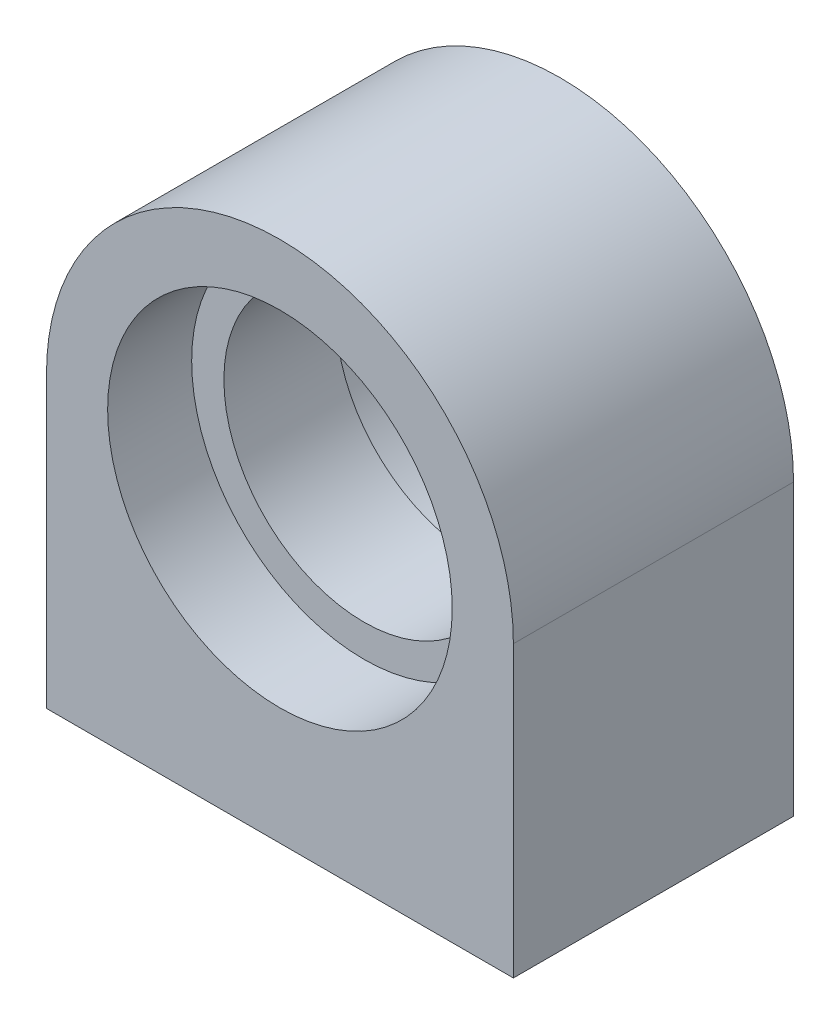
from build123d import *

# Parameters (mm, degrees)
AUFSATZ_LINEAR_AUSTRAGEN1_DEPTH = 15
SKIZZE3_R                       = 18.45
SCHNITT_LINEAR_AUSTRAGEN1_DEPTH = 9
SKIZZE4_R                       = 1.65
SCHNITT_LINEAR_AUSTRAGEN2_DEPTH = 11


with BuildPart() as part:
    # Skizze1 → Aufsatz-Linear austragen1 (new, symmetric)
    with BuildSketch(Plane.XY):
        with BuildLine():
            ThreePointArc((25, 15.5), (0, 40.5), (-25, 15.5))
            Line((-25, 15.5), (-15, 15.5))
            ThreePointArc((-15, 15.5), (0, 30.5), (15, 15.5))
            Line((15, 15.5), (25, 15.5))
        make_face()
        with BuildLine():
            Line((-15, 15.5), (-25, 15.5))
            ThreePointArc((-25, 15.5), (0, -9.5), (25, 15.5))
            Line((25, 15.5), (15, 15.5))
            ThreePointArc((15, 15.5), (0, 0.5), (-15, 15.5))
        make_face()
        with BuildLine():
            Line((-25, 15.5), (-25, -15.5))
            Line((-25, -15.5), (25, -15.5))
            Line((25, -15.5), (25, 15.5))
            ThreePointArc((25, 15.5), (0, -9.5), (-25, 15.5))
        make_face()
    extrude(amount=AUFSATZ_LINEAR_AUSTRAGEN1_DEPTH, both=True)

    # Skizze3 → Schnitt-Linear austragen1 (cut)
    with BuildSketch(Plane.XY.offset(15)):
        with Locations((0, 15.5)):
            Circle(SKIZZE3_R)
    schnitt_linear_austragen1 = extrude(amount=-SCHNITT_LINEAR_AUSTRAGEN1_DEPTH, mode=Mode.SUBTRACT)

    # Spiegeln1: Schnitt-Linear austragen1 across plane
    add(schnitt_linear_austragen1.mirror(Plane.XY), mode=Mode.SUBTRACT)

    # Skizze4 → Schnitt-Linear austragen2 (cut)
    with BuildSketch(Plane.XZ.offset(15.5)):
        with Locations(Location((-17, 0, 0), (0, 0, 270))):
            Circle(SKIZZE4_R)
        with Locations(Location((-7, 0, 0), (0, 0, 270))):
            Circle(SKIZZE4_R)
        with Locations(Location((7, 0, 0), (0, 0, 90))):
            Circle(SKIZZE4_R)
        with Locations(Location((17, 0, 0), (0, 0, 90))):
            Circle(SKIZZE4_R)
    extrude(amount=-SCHNITT_LINEAR_AUSTRAGEN2_DEPTH, mode=Mode.SUBTRACT)


solid = part.part
